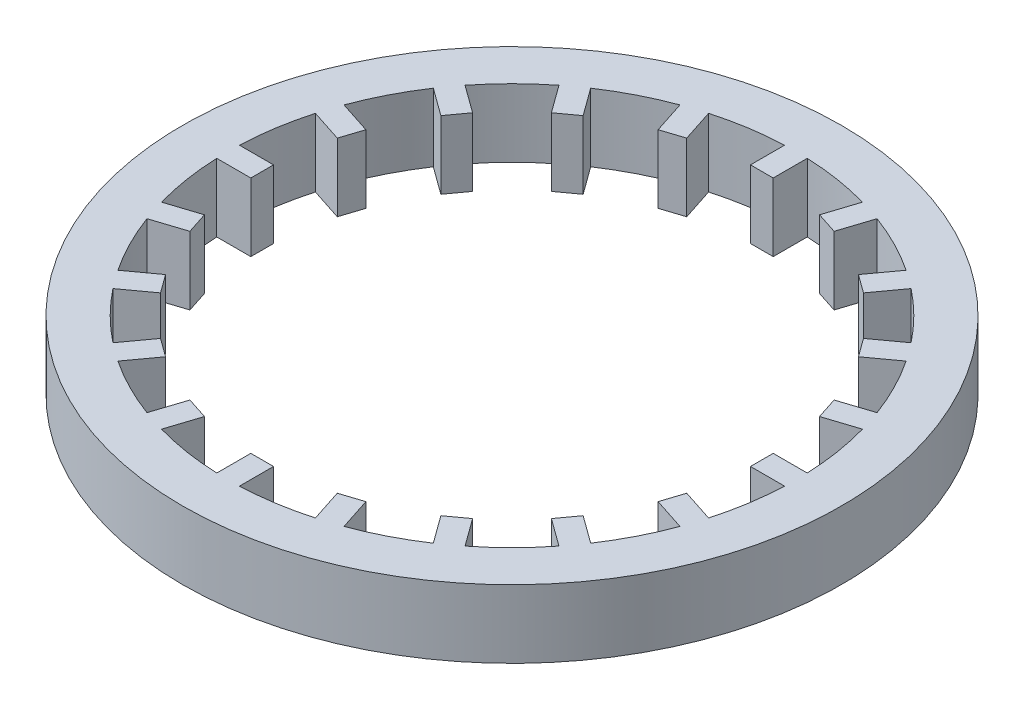
from build123d import *

# Parameters (mm, degrees)
SKETCH_2_R      = 145.099960032
EXTRUDE_1_DEPTH = 30


with BuildPart() as part:
    # 草圖2 → 填料-伸長1 (new body)
    with BuildSketch(Plane(origin=(0, 0, 0), x_dir=(1, 0, 0), z_dir=(0, 1, 0))):
        with Locations(Location((0, 0, 0), (0, 0, 270))):
            Circle(SKETCH_2_R)
        with BuildLine():
            Line((29.2365868, 106.161301764), (33.871841715, 120.427149509))
            ThreePointArc((33.871841715, 120.427149509), (19.569945324, 123.559771932), (5, 125))
            Line((5, 125), (5, 110))
            Line((5, 110), (-5, 110))
            Line((-5, 110), (-5, 125))
            ThreePointArc((-5, 125), (-19.569945324, 123.559771932), (-33.871841715, 120.427149509))
            Line((-33.871841715, 120.427149509), (-29.2365868, 106.161301764))
            Line((-29.2365868, 106.161301764), (-38.747151963, 103.071131821))
            Line((-38.747151963, 103.071131821), (-43.382406878, 117.336979565))
            ThreePointArc((-43.382406878, 117.336979565), (-56.794193372, 111.464880564), (-69.428071565, 104.066050558))
            Line((-69.428071565, 104.066050558), (-60.61129278, 91.930795643))
            Line((-60.61129278, 91.930795643), (-68.701462724, 86.05294312))
            Line((-68.701462724, 86.05294312), (-77.518241508, 98.188198035))
            ThreePointArc((-77.518241508, 98.188198035), (-88.459030065, 88.459030065), (-98.188198035, 77.518241508))
            Line((-98.188198035, 77.518241508), (-86.05294312, 68.701462724))
            Line((-86.05294312, 68.701462724), (-91.930795643, 60.61129278))
            Line((-91.930795643, 60.61129278), (-104.066050558, 69.428071565))
            ThreePointArc((-104.066050558, 69.428071565), (-111.464880564, 56.794193372), (-117.336979565, 43.382406878))
            Line((-117.336979565, 43.382406878), (-103.071131821, 38.747151963))
            Line((-103.071131821, 38.747151963), (-106.161301764, 29.2365868))
            Line((-106.161301764, 29.2365868), (-120.427149509, 33.871841715))
            ThreePointArc((-120.427149509, 33.871841715), (-123.559771932, 19.569945324), (-125, 5))
            Line((-125, 5), (-110, 5))
            Line((-110, 5), (-110, -5))
            Line((-110, -5), (-125, -5))
            ThreePointArc((-125, -5), (-123.559771932, -19.569945324), (-120.427149509, -33.871841715))
            Line((-120.427149509, -33.871841715), (-106.161301764, -29.2365868))
            Line((-106.161301764, -29.2365868), (-103.071131821, -38.747151963))
            Line((-103.071131821, -38.747151963), (-117.336979565, -43.382406878))
            ThreePointArc((-117.336979565, -43.382406878), (-111.464880564, -56.794193372), (-104.066050558, -69.428071565))
            Line((-104.066050558, -69.428071565), (-91.930795643, -60.61129278))
            Line((-91.930795643, -60.61129278), (-86.05294312, -68.701462724))
            Line((-86.05294312, -68.701462724), (-98.188198035, -77.518241508))
            ThreePointArc((-98.188198035, -77.518241508), (-88.459030065, -88.459030065), (-77.518241508, -98.188198035))
            Line((-77.518241508, -98.188198035), (-68.701462724, -86.05294312))
            Line((-68.701462724, -86.05294312), (-60.61129278, -91.930795643))
            Line((-60.61129278, -91.930795643), (-69.428071565, -104.066050558))
            ThreePointArc((-69.428071565, -104.066050558), (-56.794193372, -111.464880564), (-43.382406878, -117.336979565))
            Line((-43.382406878, -117.336979565), (-38.747151963, -103.071131821))
            Line((-38.747151963, -103.071131821), (-29.2365868, -106.161301764))
            Line((-29.2365868, -106.161301764), (-33.871841715, -120.427149509))
            ThreePointArc((-33.871841715, -120.427149509), (-19.569945324, -123.559771932), (-5, -125))
            Line((-5, -125), (-5, -110))
            Line((-5, -110), (5, -110))
            Line((5, -110), (5, -125))
            ThreePointArc((5, -125), (19.569945324, -123.559771932), (33.871841715, -120.427149509))
            Line((33.871841715, -120.427149509), (29.2365868, -106.161301764))
            Line((29.2365868, -106.161301764), (38.747151963, -103.071131821))
            Line((38.747151963, -103.071131821), (43.382406878, -117.336979565))
            ThreePointArc((43.382406878, -117.336979565), (56.794193372, -111.464880564), (69.428071565, -104.066050558))
            Line((69.428071565, -104.066050558), (60.61129278, -91.930795643))
            Line((60.61129278, -91.930795643), (68.701462724, -86.05294312))
            Line((68.701462724, -86.05294312), (77.518241508, -98.188198035))
            ThreePointArc((77.518241508, -98.188198035), (88.459030065, -88.459030065), (98.188198035, -77.518241508))
            Line((98.188198035, -77.518241508), (86.05294312, -68.701462724))
            Line((86.05294312, -68.701462724), (91.930795643, -60.61129278))
            Line((91.930795643, -60.61129278), (104.066050558, -69.428071565))
            ThreePointArc((104.066050558, -69.428071565), (111.464880564, -56.794193372), (117.336979565, -43.382406878))
            Line((117.336979565, -43.382406878), (103.071131821, -38.747151963))
            Line((103.071131821, -38.747151963), (106.161301764, -29.2365868))
            Line((106.161301764, -29.2365868), (120.427149509, -33.871841715))
            ThreePointArc((120.427149509, -33.871841715), (123.559771932, -19.569945324), (125, -5))
            Line((125, -5), (110, -5))
            Line((110, -5), (110, 5))
            Line((110, 5), (125, 5))
            ThreePointArc((125, 5), (123.559771932, 19.569945324), (120.427149509, 33.871841715))
            Line((120.427149509, 33.871841715), (106.161301764, 29.2365868))
            Line((106.161301764, 29.2365868), (103.071131821, 38.747151963))
            Line((103.071131821, 38.747151963), (117.336979565, 43.382406878))
            ThreePointArc((117.336979565, 43.382406878), (111.464880564, 56.794193372), (104.066050558, 69.428071565))
            Line((104.066050558, 69.428071565), (91.930795643, 60.61129278))
            Line((91.930795643, 60.61129278), (86.05294312, 68.701462724))
            Line((86.05294312, 68.701462724), (98.188198035, 77.518241508))
            ThreePointArc((98.188198035, 77.518241508), (88.459030065, 88.459030065), (77.518241508, 98.188198035))
            Line((77.518241508, 98.188198035), (68.701462724, 86.05294312))
            Line((68.701462724, 86.05294312), (60.61129278, 91.930795643))
            Line((60.61129278, 91.930795643), (69.428071565, 104.066050558))
            ThreePointArc((69.428071565, 104.066050558), (56.794193372, 111.464880564), (43.382406878, 117.336979565))
            Line((43.382406878, 117.336979565), (38.747151963, 103.071131821))
            Line((38.747151963, 103.071131821), (29.2365868, 106.161301764))
        make_face(mode=Mode.SUBTRACT)
    extrude(amount=EXTRUDE_1_DEPTH)


solid = part.part
